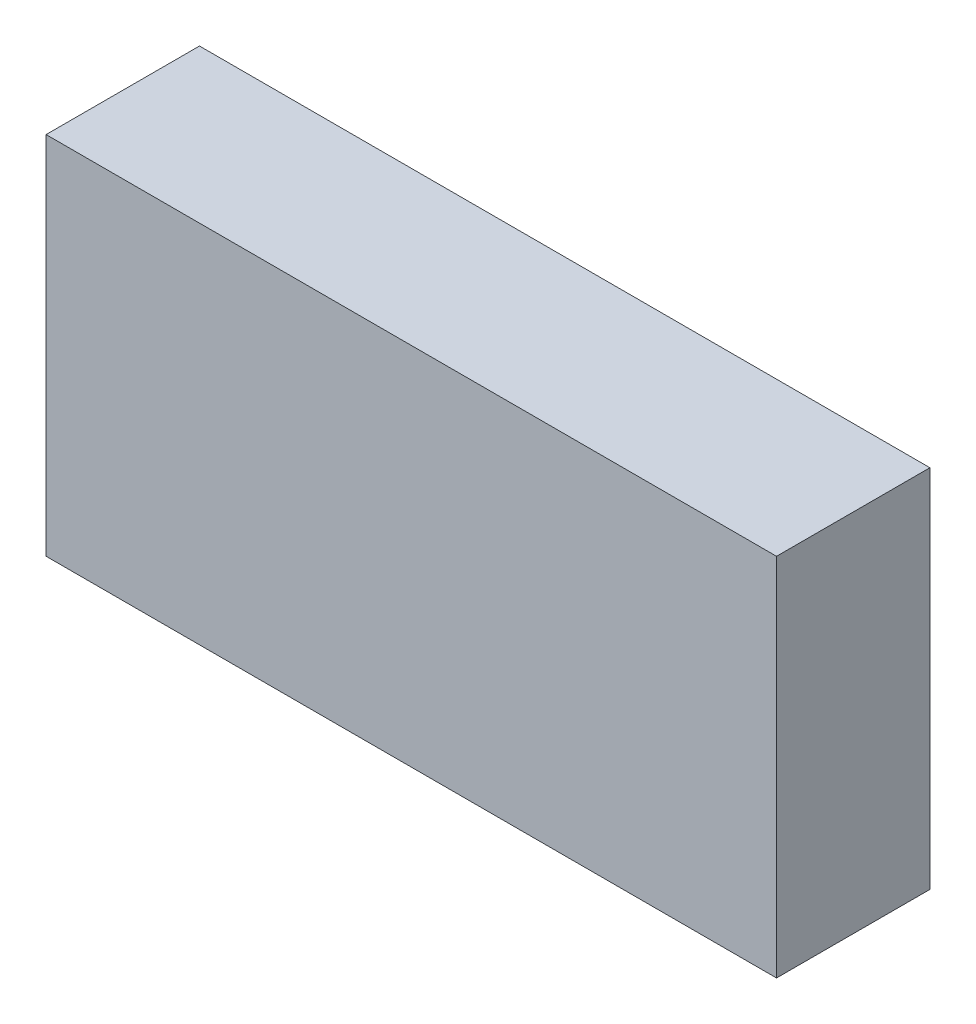
from build123d import *

# Parameters (mm, degrees)
SKETCH1_W           = 25.4
SKETCH1_H           = 12.7
BOSS_EXTRUDE1_DEPTH = 5.334


with BuildPart() as part:
    # Sketch1 → Boss-Extrude1 (new body)
    with BuildSketch(Plane.XY):
        with Locations((12.7, -6.35)):
            Rectangle(SKETCH1_W, SKETCH1_H)
    extrude(amount=BOSS_EXTRUDE1_DEPTH)


solid = part.part
